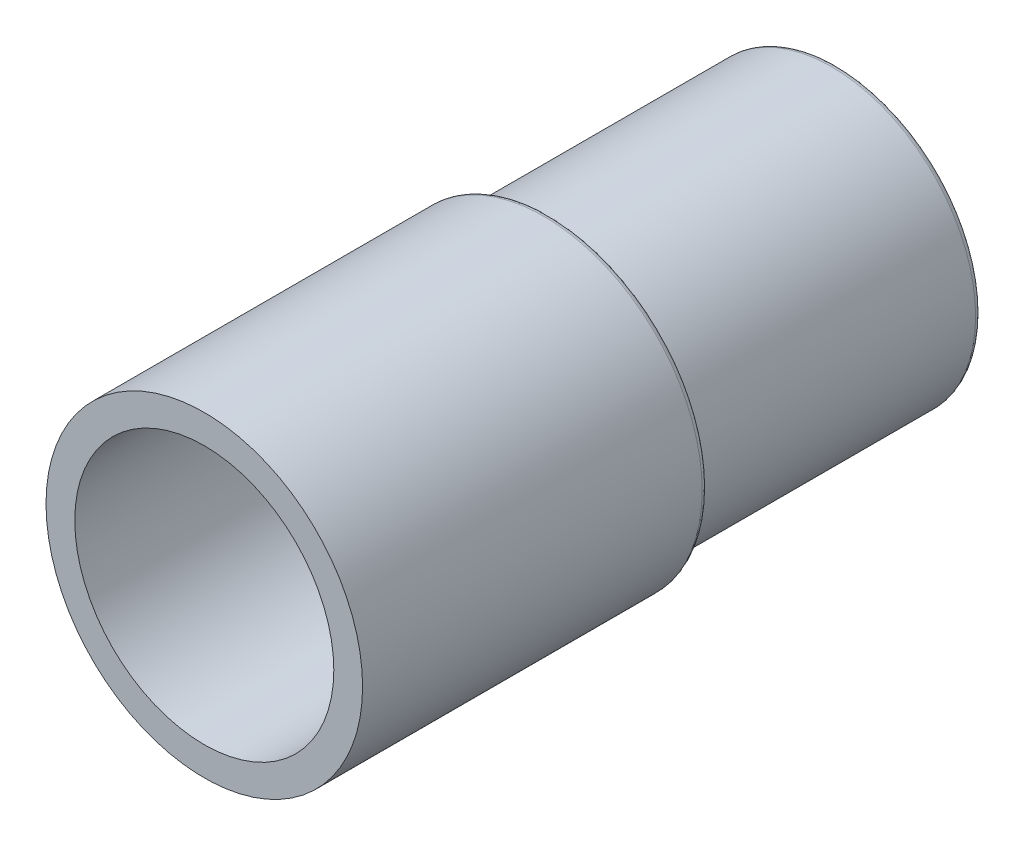
from build123d import *

# Parameters (mm, degrees)
SKETCH_1_R      = 2.5
SKETCH_1_R_2    = 2
EXTRUDE_1_DEPTH = 5
SKETCH_2_R      = 2.75
SKETCH_2_R_2    = 2.25
EXTRUDE_2_DEPTH = 6
FILLET_1_R      = 0.1


with BuildPart() as part:
    # Эскиз1 → Вытянуть1 (new body)
    with BuildSketch(Plane.XY):
        Circle(SKETCH_1_R)
        Circle(SKETCH_1_R_2, mode=Mode.SUBTRACT)
    extrude(amount=EXTRUDE_1_DEPTH)

    # Эскиз2 → Вытянуть2 (add)
    with BuildSketch(Plane.XY.offset(5)):
        Circle(SKETCH_2_R)
        Circle(SKETCH_2_R_2, mode=Mode.SUBTRACT)
    extrude(amount=EXTRUDE_2_DEPTH)

    # Скругление1
    fillet_1_edges = [part.edges().sort_by_distance(p)[0] for p in [
        (-2.5, 0, 0),
        (-2.5, 0, 5),
        (-2.75, 0, 5),
    ]]
    fillet(fillet_1_edges, radius=FILLET_1_R)


solid = part.part
